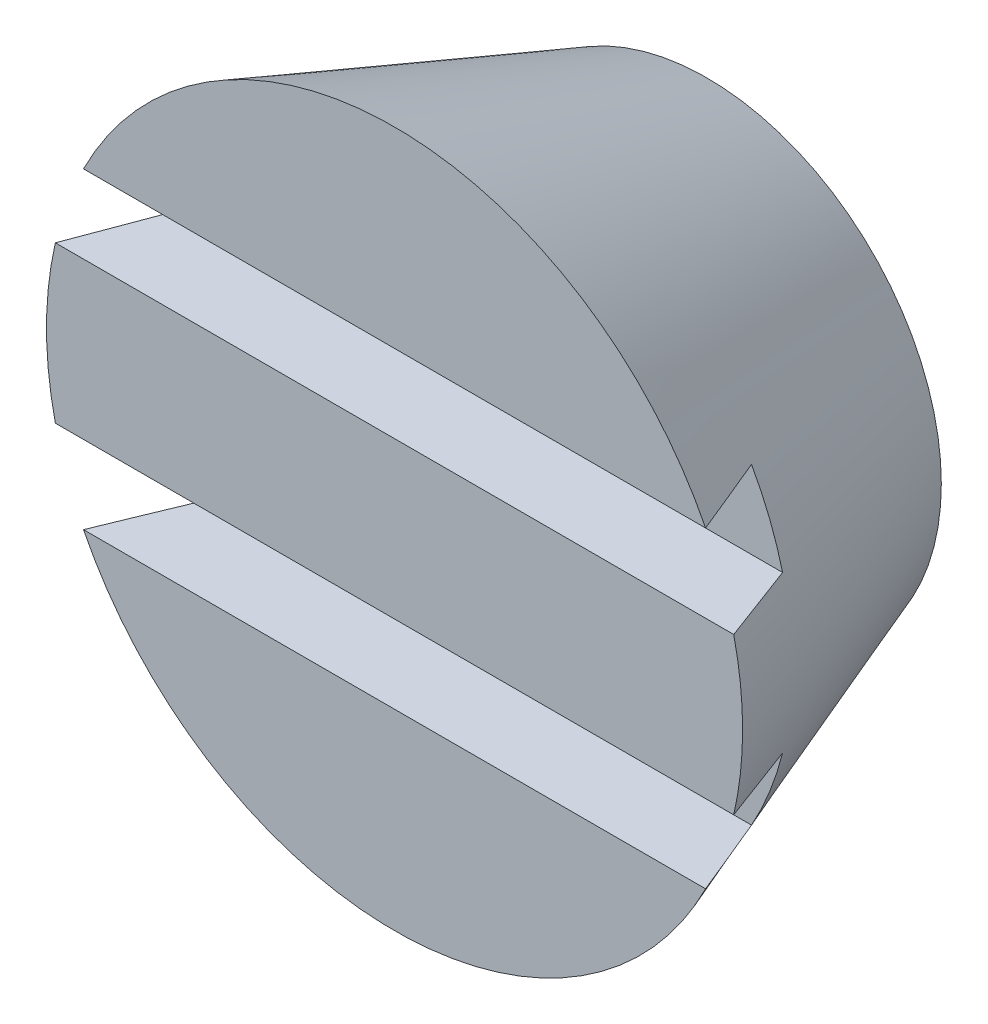
from build123d import *

# Parameters (mm, degrees)
ESQUISSE1_R             = 15
BOSS_EXTRU_1_DEPTH      = 20
BOSS_EXTRU_1_DRAFT      = -20
ESQUISSE2_W             = 49.259331118
ESQUISSE2_H             = 5
ENL_V_MAT_EXTRU_1_DEPTH = 5


with BuildPart() as part:
    # Esquisse1 → Boss.-Extru.1 (with draft: the straight prism first)
    with BuildSketch(Plane.XY):
        Circle(ESQUISSE1_R)
    extrude(amount=BOSS_EXTRU_1_DEPTH)
    # Boss.-Extru.1: the draft: its side faces are tilted about the plane it starts from
    boss_extru_1_sides = [part.faces().sort_by_distance(p)[0] for p in [
        (-15, 0, 10),
    ]]
    draft(boss_extru_1_sides, Plane.XY, BOSS_EXTRU_1_DRAFT)

    # Esquisse2 → Enlèv. mat.-Extru.1 (cut)
    with BuildSketch(Plane.XY.offset(20)):
        with Locations((0, -7.5)):
            Rectangle(ESQUISSE2_W, ESQUISSE2_H)
        with Locations((0, 7.5)):
            Rectangle(ESQUISSE2_W, ESQUISSE2_H)
    extrude(amount=-ENL_V_MAT_EXTRU_1_DEPTH, mode=Mode.SUBTRACT)


solid = part.part
